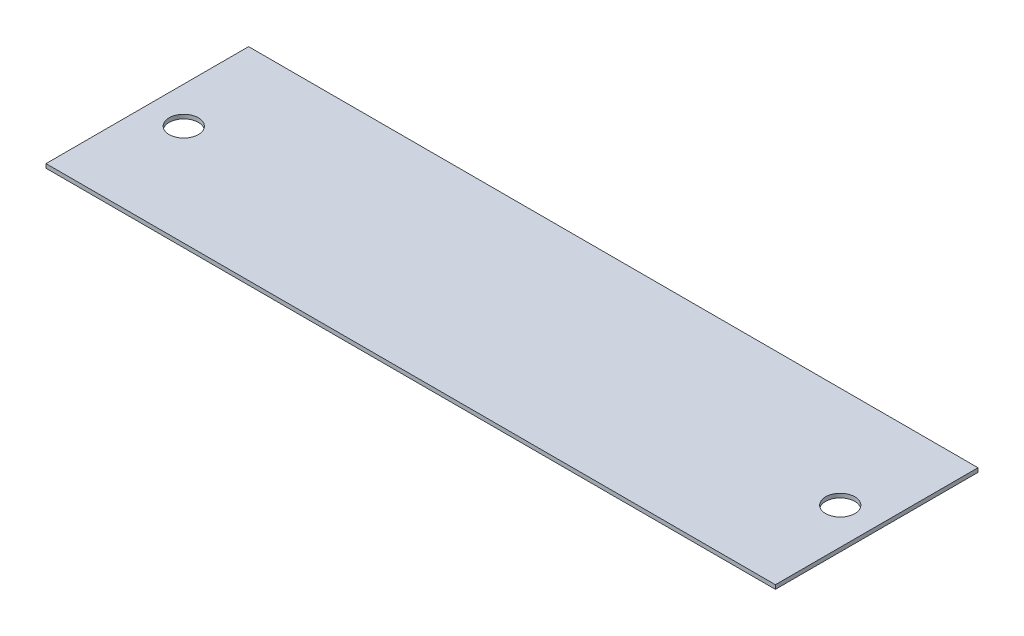
from build123d import *

# Parameters (mm, degrees)
CROQUIS1_W              = 90
CROQUIS1_H              = 25
SALIENTE_EXTRUIR1_DEPTH = 0.5
CROQUIS2_R              = 1.8
CORTAR_EXTRUIR1_DEPTH   = 0.5


with BuildPart() as part:
    # Croquis1 → Saliente-Extruir1 (new body)
    with BuildSketch(Plane(origin=(0, 0, 0), x_dir=(1, 0, 0), z_dir=(0, 1, 0))):
        Rectangle(CROQUIS1_W, CROQUIS1_H)
    extrude(amount=SALIENTE_EXTRUIR1_DEPTH)

    # Croquis2 → Cortar-Extruir1 (cut)
    with BuildSketch(Plane(origin=(0, 0.5, 0), x_dir=(1, 0, 0), z_dir=(0, 1, 0))):
        with Locations(Location((-40.5, 0, 0), (0, 0, 270))):
            Circle(CROQUIS2_R)
        with Locations(Location((40.5, 0, 0), (0, 0, 270))):
            Circle(CROQUIS2_R)
    extrude(amount=-CORTAR_EXTRUIR1_DEPTH, mode=Mode.SUBTRACT)


solid = part.part
